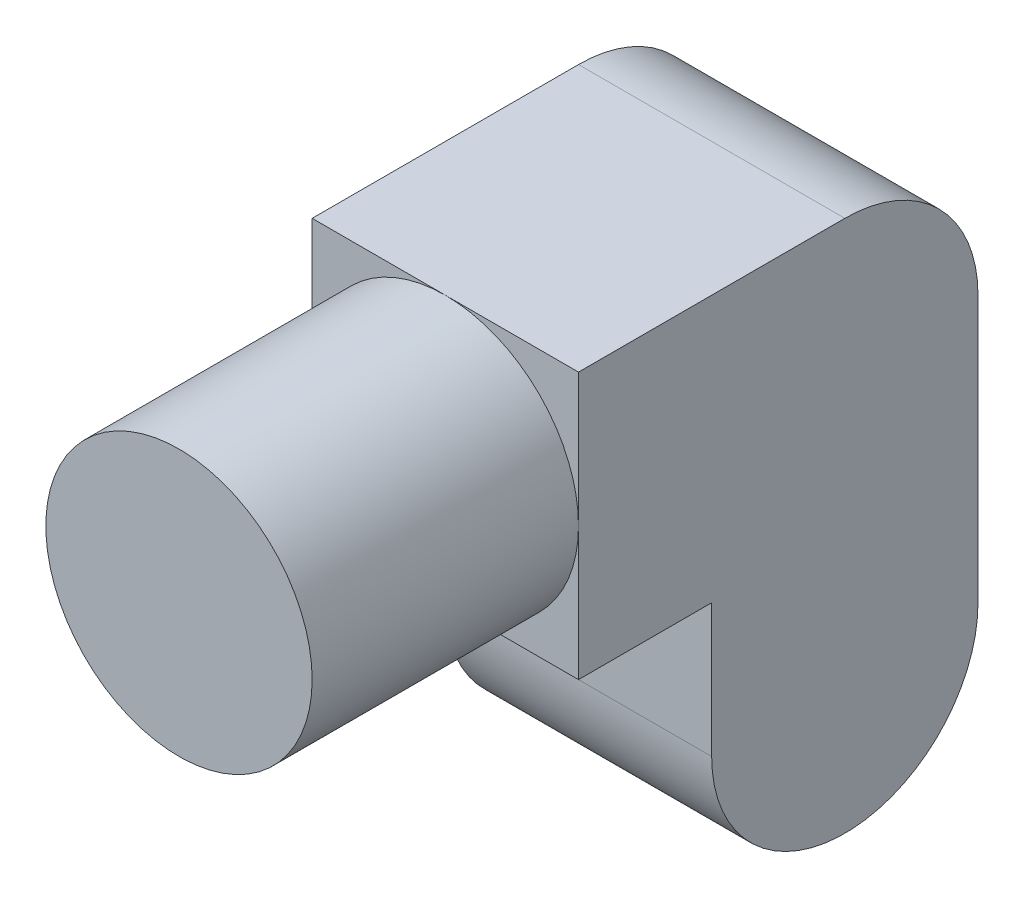
from build123d import *

# Parameters (mm, degrees)
BOSS_EXTRUDE1_DEPTH = 80
SKETCH3_R           = 40
BOSS_EXTRUDE2_DEPTH = 40
CUT_EXTRUDE3_START  = -40
CUT_EXTRUDE3_DEPTH  = 40


with BuildPart() as part:
    # Sketch2 → Boss-Extrude1 (new body)
    with BuildSketch(Plane(origin=(0, 0, 0), x_dir=(0, 0, -1), z_dir=(1, 0, 0))):
        with BuildLine():
            Line((-80, -40), (0, -40))
            Line((0, -40), (0, -80))
            ThreePointArc((0, -80), (40, -120), (80, -80))
            Line((80, -80), (80, -40))
            Line((80, -40), (80, 0))
            ThreePointArc((80, 0), (68.284271247, 28.284271247), (40, 40))
            Line((40, 40), (-80, 40))
            Line((-80, 40), (-80, -40))
        make_face()
    extrude(amount=BOSS_EXTRUDE1_DEPTH)

    # Sketch3 → Boss-Extrude2 (add)
    with BuildSketch(Plane.XY.offset(80)):
        with Locations((40, 0)):
            Circle(SKETCH3_R)
    extrude(amount=BOSS_EXTRUDE2_DEPTH)

    # Sketch5 → Cut-Extrude3 (cut)
    with BuildSketch(Plane.XY.offset(80).offset(CUT_EXTRUDE3_START)):
        with BuildLine():
            Line((40, 40), (0, 40))
            Line((0, 40), (0, 0))
            ThreePointArc((0, 0), (11.715728753, 28.284271247), (40, 40))
        make_face()
        with BuildLine():
            Line((80, 40), (40, 40))
            ThreePointArc((40, 40), (68.284271247, 28.284271247), (80, 0))
            Line((80, 0), (80, 40))
        make_face()
        with BuildLine():
            ThreePointArc((40, -40), (11.715728753, -28.284271247), (0, 0))
            Line((0, 0), (0, -40))
            Line((0, -40), (40, -40))
        make_face()
        with BuildLine():
            Line((80, -40), (80, 0))
            ThreePointArc((80, 0), (68.284271247, -28.284271247), (40, -40))
            Line((40, -40), (80, -40))
        make_face()
    extrude(amount=CUT_EXTRUDE3_DEPTH, mode=Mode.SUBTRACT)


solid = part.part
